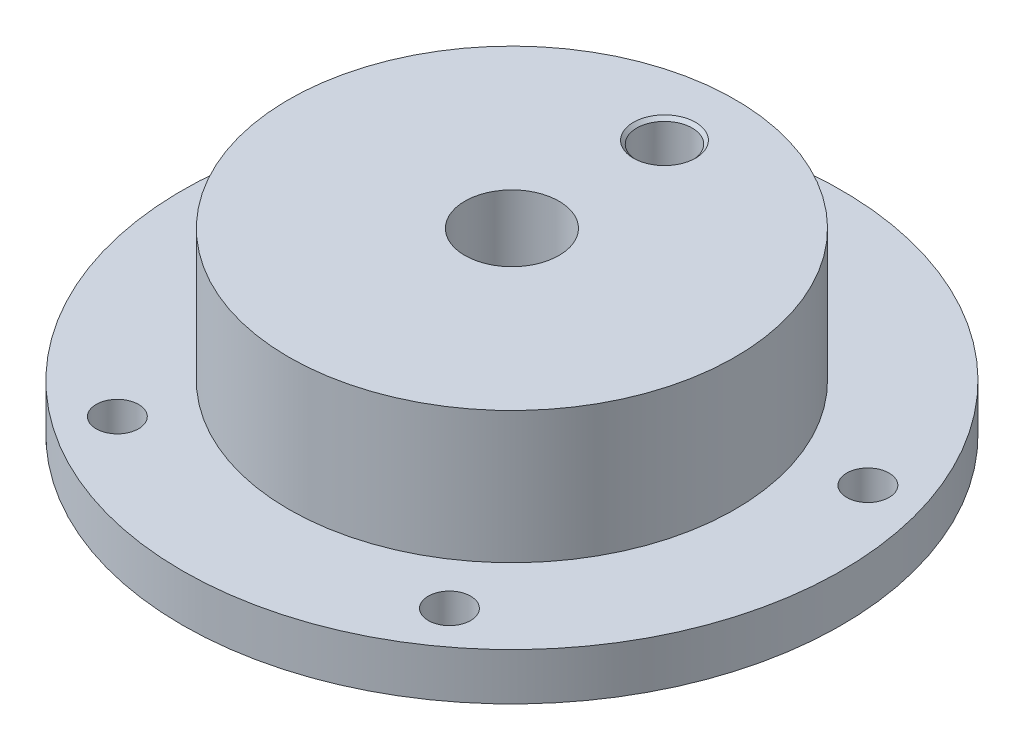
from build123d import *

# Parameters (mm, degrees)
G1_4_TAPPED_HOLE1_D           = 11.8
G1_4_TAPPED_HOLE1_CSINK_D     = 13.207
G1_4_TAPPED_HOLE1_CSINK_ANGLE = 90
SKETCH5_R                     = 4.5
CUT_EXTRUDE1_DEPTH            = 10
CIRPATTERN1_COUNT             = 5


with BuildPart() as part:
    # Sketch1 → Revolve1 (revolve)
    with BuildSketch(Plane.XY, mode=Mode.PRIVATE) as revolve1_sk:
        with BuildLine():
            Line((-10, 0), (-10, -38))
            Line((-10, -38), (-12.5, -38))
            Line((-12.5, -38), (-12.5, -36.2))
            ThreePointArc((-12.5, -36.2), (-12.558578644, -36.058578644), (-12.7, -36))
            Line((-12.7, -36), (-15.541966742, -36))
            ThreePointArc((-15.541966742, -36), (-15.689068469, -36.060931531), (-15.75, -36.208033258))
            Line((-15.75, -36.208033258), (-15.75, -38))
            Line((-15.75, -38), (-18.5, -38))
            Line((-18.5, -38), (-18.5, -36.208033258))
            ThreePointArc((-18.5, -36.208033258), (-18.560931531, -36.060931531), (-18.708033258, -36))
            Line((-18.708033258, -36), (-21.541966742, -36))
            ThreePointArc((-21.541966742, -36), (-21.689068469, -36.060931531), (-21.75, -36.208033258))
            Line((-21.75, -36.208033258), (-21.75, -38))
            Line((-21.75, -38), (-24, -38))
            Line((-24, -38), (-24, -10))
            Line((-24, -10), (-39.4, -10))
            Line((-39.4, -10), (-39.4, -38))
            Line((-39.4, -38), (-42, -38))
            Line((-42, -38), (-42, -36.208033258))
            ThreePointArc((-42, -36.208033258), (-42.060931531, -36.060931531), (-42.208033258, -36))
            Line((-42.208033258, -36), (-45.041966742, -36))
            ThreePointArc((-45.041966742, -36), (-45.189068469, -36.060931531), (-45.25, -36.208033258))
            Line((-45.25, -36.208033258), (-45.25, -38))
            Line((-45.25, -38), (-47.75, -38))
            Line((-47.75, -38), (-47.75, -36.208033258))
            ThreePointArc((-47.75, -36.208033258), (-47.810931531, -36.060931531), (-47.958033258, -36))
            Line((-47.958033258, -36), (-50.791966742, -36))
            ThreePointArc((-50.791966742, -36), (-50.939068469, -36.060931531), (-51, -36.208033258))
            Line((-51, -36.208033258), (-51, -38))
            Line((-51, -38), (-70, -38))
            Line((-70, -38), (-70, -28))
            Line((-70, -28), (-47.4, -28))
            Line((-47.4, -28), (-47.4, 0))
            Line((-47.4, 0), (-10, 0))
        make_face()
    revolve(revolve1_sk.sketch.rotate(Axis((0, 0, 0), (0, -1, 0)), 270), axis=Axis((0, 0, 0), (0, -1, 0)))

    # G1/4 Tapped Hole1 (through all)
    with Locations(Plane(origin=(0, 0, 0), x_dir=(1, 0, 0), z_dir=(0, 1, 0))):
        with Locations((0, 32.4)):
            CounterSinkHole(G1_4_TAPPED_HOLE1_D / 2, G1_4_TAPPED_HOLE1_CSINK_D / 2, counter_sink_angle=G1_4_TAPPED_HOLE1_CSINK_ANGLE)

    # Sketch5 → Cut-Extrude1 (cut)
    with BuildSketch(Plane(origin=(0, -28, 0), x_dir=(1, 0, 0), z_dir=(0, 1, 0))):
        with Locations(Location((0, 60, 0), (0, 0, 270))):
            Circle(SKETCH5_R)
    cut_extrude1 = extrude(amount=-CUT_EXTRUDE1_DEPTH, mode=Mode.SUBTRACT)

    # CirPattern1: Cut-Extrude1 ×5 about axis
    cirpattern1_axis = Axis((0, 0, 0), (0, 1, 0))
    for i in range(1, CIRPATTERN1_COUNT):
        add(cut_extrude1.rotate(cirpattern1_axis, i * 360 / CIRPATTERN1_COUNT), mode=Mode.SUBTRACT)


solid = part.part
